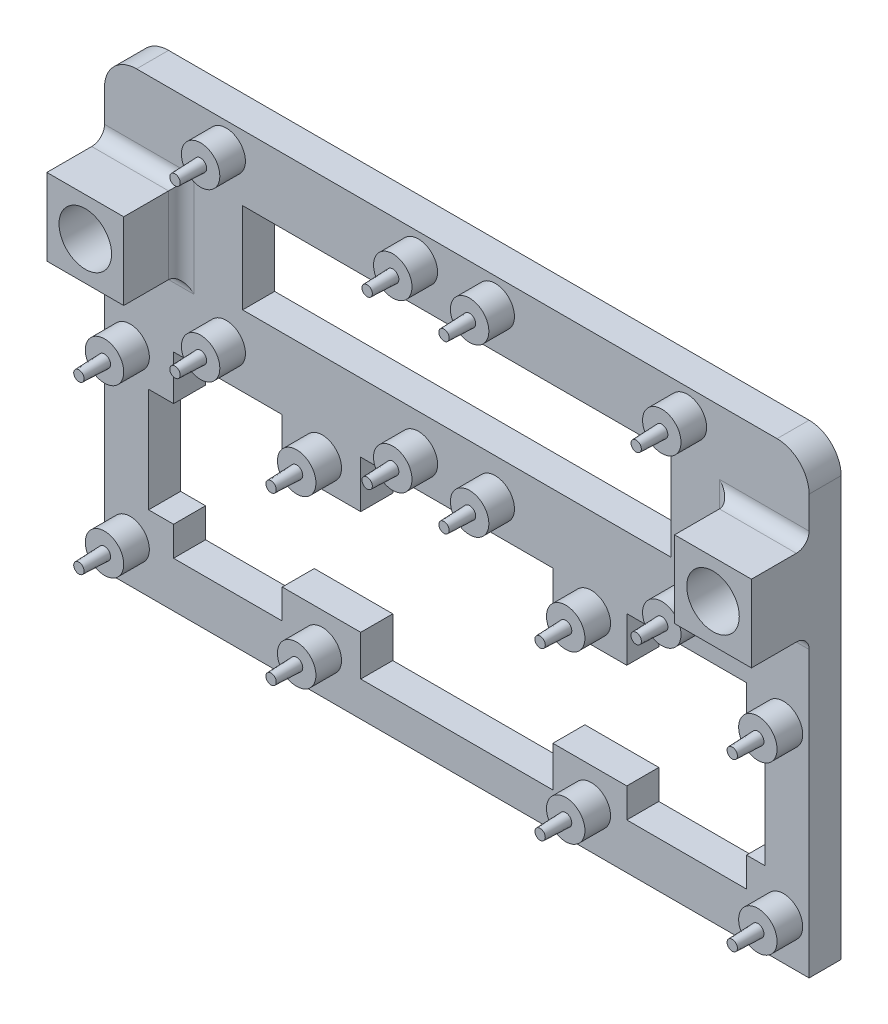
from build123d import *

# Parameters (mm, degrees)
SKIZZE1_W                                  = 110
SKIZZE1_H                                  = 170
AUFSATZ_LINEAR_AUSTRAGEN1_DEPTH            = 5
VERRUNDUNG1_R                              = 5
SKIZZE7_W                                  = 12
SKIZZE7_H                                  = 12
AUFSATZ_LINEAR_AUSTRAGEN3_DEPTH            = 28
VERRUNDUNG2_R                              = 2
SKIZZE8_R                                  = 4.1
SCHNITT_LINEAR_AUSTRAGEN3_DEPTH            = 107.484740691
LINEARES_MUSTER1_COUNT                     = 2
LINEARES_MUSTER1_PITCH                     = 134
LINEARES_MUSTER1_COUNT_DIR2                = 2
LINEARES_MUSTER1_PITCH_DIR2                = 98
SKIZZE9_R                                  = 3
AUFSATZ_LINEAR_AUSTRAGEN4_DEPTH            = 4
SKIZZE10_R                                 = 0.95
AUFSATZ_LINEAR_AUSTRAGEN5_DEPTH            = 4
AUFSATZ_LINEAR_AUSTRAGEN5_DRAFT            = 2
AUFSATZ_LINEAR_AUSTRAGEN5_PROFILE_2_DEPTH  = 4
AUFSATZ_LINEAR_AUSTRAGEN5_PROFILE_2_DRAFT  = 2
AUFSATZ_LINEAR_AUSTRAGEN5_PROFILE_3_DEPTH  = 4
AUFSATZ_LINEAR_AUSTRAGEN5_PROFILE_3_DRAFT  = 2
AUFSATZ_LINEAR_AUSTRAGEN5_PROFILE_4_DEPTH  = 4
AUFSATZ_LINEAR_AUSTRAGEN5_PROFILE_4_DRAFT  = 2
AUFSATZ_LINEAR_AUSTRAGEN5_PROFILE_5_DEPTH  = 4
AUFSATZ_LINEAR_AUSTRAGEN5_PROFILE_5_DRAFT  = 2
AUFSATZ_LINEAR_AUSTRAGEN5_PROFILE_6_DEPTH  = 4
AUFSATZ_LINEAR_AUSTRAGEN5_PROFILE_6_DRAFT  = 2
AUFSATZ_LINEAR_AUSTRAGEN5_PROFILE_7_DEPTH  = 4
AUFSATZ_LINEAR_AUSTRAGEN5_PROFILE_7_DRAFT  = 2
AUFSATZ_LINEAR_AUSTRAGEN5_PROFILE_8_DEPTH  = 4
AUFSATZ_LINEAR_AUSTRAGEN5_PROFILE_8_DRAFT  = 2
AUFSATZ_LINEAR_AUSTRAGEN5_PROFILE_9_DEPTH  = 4
AUFSATZ_LINEAR_AUSTRAGEN5_PROFILE_9_DRAFT  = 2
AUFSATZ_LINEAR_AUSTRAGEN5_PROFILE_10_DEPTH = 4
AUFSATZ_LINEAR_AUSTRAGEN5_PROFILE_10_DRAFT = 2
AUFSATZ_LINEAR_AUSTRAGEN5_PROFILE_11_DEPTH = 4
AUFSATZ_LINEAR_AUSTRAGEN5_PROFILE_11_DRAFT = 2
AUFSATZ_LINEAR_AUSTRAGEN5_PROFILE_12_DEPTH = 4
AUFSATZ_LINEAR_AUSTRAGEN5_PROFILE_12_DRAFT = 2
AUFSATZ_LINEAR_AUSTRAGEN5_PROFILE_13_DEPTH = 4
AUFSATZ_LINEAR_AUSTRAGEN5_PROFILE_13_DRAFT = 2
AUFSATZ_LINEAR_AUSTRAGEN5_PROFILE_14_DEPTH = 4
AUFSATZ_LINEAR_AUSTRAGEN5_PROFILE_14_DRAFT = 2
AUFSATZ_LINEAR_AUSTRAGEN5_PROFILE_15_DEPTH = 4
AUFSATZ_LINEAR_AUSTRAGEN5_PROFILE_15_DRAFT = 2
AUFSATZ_LINEAR_AUSTRAGEN5_PROFILE_16_DEPTH = 4
AUFSATZ_LINEAR_AUSTRAGEN5_PROFILE_16_DRAFT = 2
AUFSATZ_LINEAR_AUSTRAGEN5_PROFILE_17_DEPTH = 4
AUFSATZ_LINEAR_AUSTRAGEN5_PROFILE_17_DRAFT = 2
AUFSATZ_LINEAR_AUSTRAGEN5_PROFILE_18_DEPTH = 4
AUFSATZ_LINEAR_AUSTRAGEN5_PROFILE_18_DRAFT = 2
AUFSATZ_LINEAR_AUSTRAGEN5_PROFILE_19_DEPTH = 4
AUFSATZ_LINEAR_AUSTRAGEN5_PROFILE_19_DRAFT = 2
AUFSATZ_LINEAR_AUSTRAGEN5_PROFILE_20_DEPTH = 4
AUFSATZ_LINEAR_AUSTRAGEN5_PROFILE_20_DRAFT = 2
FASE1_SIZE                                 = 1.2
SKIZZE11_W                                 = 30
SKIZZE11_H                                 = 30
SCHNITT_LINEAR_AUSTRAGEN4_DEPTH            = 106.0428484
SCHNITT_LINEAR_AUSTRAGEN5_DEPTH            = 106.0428484
SCHNITT_LINEAR_AUSTRAGEN5_DEPTH_BACK       = 106.0428484
SKIZZE12_W                                 = 127.246732026
SKIZZE12_H                                 = 102.785709754
SKIZZE13_W                                 = 132.216184194
SKIZZE13_H                                 = 22.314967796
SCHNITT_LINEAR_AUSTRAGEN6_DEPTH            = 19
SKIZZE14_W                                 = 16.970787643
SKIZZE14_H                                 = 27.901125447
SKIZZE14_W_2                               = 66.876408934
SKIZZE14_H_2                               = 14.094382958
SKIZZE14_W_3                               = 18.696630454
SCHNITT_LINEAR_AUSTRAGEN7_DEPTH            = 102.641526946
SKIZZE15_W                                 = 96.238062378
SKIZZE15_H                                 = 16.307348182
SCHNITT_LINEAR_AUSTRAGEN8_DEPTH            = 102.641526946


with BuildPart() as part:
    # Skizze1 → Aufsatz-Linear austragen1 (new body)
    with BuildSketch(Plane.XY):
        Rectangle(SKIZZE1_W, SKIZZE1_H)
    extrude(amount=AUFSATZ_LINEAR_AUSTRAGEN1_DEPTH)

    # Verrundung1
    verrundung1_edges = [part.edges().sort_by_distance(p)[0] for p in [
        (55, -85, 2.5),
        (-55, -85, 2.5),
        (-55, 85, 2.5),
        (55, 85, 2.5),
    ]]
    fillet(verrundung1_edges, radius=VERRUNDUNG1_R)

    # Skizze7 → Aufsatz-Linear austragen3 (add)
    with BuildSketch(Plane.XY.offset(5)):
        with Locations((-49, 67)):
            Rectangle(SKIZZE7_W, SKIZZE7_H)
        with Locations((49, 67)):
            Rectangle(SKIZZE7_W, SKIZZE7_H)
        with Locations((49, -67)):
            Rectangle(SKIZZE7_W, SKIZZE7_H)
        with Locations((-49, -67)):
            Rectangle(SKIZZE7_W, SKIZZE7_H)
    extrude(amount=AUFSATZ_LINEAR_AUSTRAGEN3_DEPTH)

    # Verrundung2
    verrundung2_edges = [part.edges().sort_by_distance(p)[0] for p in [
        (-49, 61, 5),
        (-43, 67, 5),
        (-49, 73, 5),
        (49, 73, 5),
        (43, 67, 5),
        (49, 61, 5),
        (49, -61, 5),
        (43, -67, 5),
        (49, -73, 5),
        (-49, -73, 5),
        (-43, -67, 5),
        (-49, -61, 5),
    ]]
    fillet(verrundung2_edges, radius=VERRUNDUNG2_R)

    # Skizze8 → Schnitt-Linear austragen3 (cut, through all)
    with BuildSketch(Plane.XY.offset(33)):
        with Locations((-49, 67)):
            Circle(SKIZZE8_R)
    schnitt_linear_austragen3 = extrude(amount=-SCHNITT_LINEAR_AUSTRAGEN3_DEPTH, mode=Mode.SUBTRACT)

    # Lineares Muster1: Schnitt-Linear austragen3 2 × 2
    with Locations(*[(j * LINEARES_MUSTER1_PITCH_DIR2, -i * LINEARES_MUSTER1_PITCH, 0) for i in range(LINEARES_MUSTER1_COUNT) for j in range(LINEARES_MUSTER1_COUNT_DIR2) if (i, j) != (0, 0)]):
        add(schnitt_linear_austragen3, mode=Mode.SUBTRACT)

    # Skizze9 → Aufsatz-Linear austragen4 (add)
    with BuildSketch(Plane.XY.offset(5)):
        with Locations(Location((24.75, -73.75, 0), (0, 0, 180))):
            Circle(SKIZZE9_R)
        with Locations(Location((24.75, -16.25, 0), (0, 0, 180))):
            Circle(SKIZZE9_R)
        with Locations(Location((-24.75, -16.25, 0), (0, 0, 180))):
            Circle(SKIZZE9_R)
        with Locations(Location((-24.75, -73.75, 0), (0, 0, 180))):
            Circle(SKIZZE9_R)
        with Locations(Location((-36, 81, 0), (0, 0, 180))):
            Circle(SKIZZE9_R)
        with Locations(Location((-6, 81, 0), (0, 0, 180))):
            Circle(SKIZZE9_R)
        with Locations(Location((-36, 55, 0), (0, 0, 180))):
            Circle(SKIZZE9_R)
        with Locations(Location((-6, 55, 0), (0, 0, 180))):
            Circle(SKIZZE9_R)
        with Locations(Location((6, 81, 0), (0, 0, 180))):
            Circle(SKIZZE9_R)
        with Locations(Location((36, 81, 0), (0, 0, 180))):
            Circle(SKIZZE9_R)
        with Locations(Location((36, 55, 0), (0, 0, 180))):
            Circle(SKIZZE9_R)
        with Locations(Location((6, 55, 0), (0, 0, 180))):
            Circle(SKIZZE9_R)
        with Locations(Location((21, 47, 0), (0, 0, 180))):
            Circle(SKIZZE9_R)
        with Locations(Location((51, 47, 0), (0, 0, 180))):
            Circle(SKIZZE9_R)
        with Locations(Location((51, 21, 0), (0, 0, 180))):
            Circle(SKIZZE9_R)
        with Locations(Location((21, 21, 0), (0, 0, 180))):
            Circle(SKIZZE9_R)
        with Locations(Location((-21, 47, 0), (0, 0, 180))):
            Circle(SKIZZE9_R)
        with Locations(Location((-51, 47, 0), (0, 0, 180))):
            Circle(SKIZZE9_R)
        with Locations(Location((-51, 21, 0), (0, 0, 180))):
            Circle(SKIZZE9_R)
        with Locations(Location((-21, 21, 0), (0, 0, 180))):
            Circle(SKIZZE9_R)
    extrude(amount=AUFSATZ_LINEAR_AUSTRAGEN4_DEPTH)


with BuildPart() as aufsatz_linear_austragen5_tool:
    # Skizze10 → Aufsatz-Linear austragen5 (with draft: the straight prism first)
    with BuildSketch(Plane.XY.offset(9)):
        with Locations((24.75, -73.75)):
            Circle(SKIZZE10_R)
    extrude(amount=AUFSATZ_LINEAR_AUSTRAGEN5_DEPTH)
    # Aufsatz-Linear austragen5: the draft: its side faces are tilted about the plane it starts from
    aufsatz_linear_austragen5_sides = [aufsatz_linear_austragen5_tool.faces().sort_by_distance(p)[0] for p in [
        (23.8, -73.75, 11),
    ]]
    draft(aufsatz_linear_austragen5_sides, Plane.XY.offset(9), AUFSATZ_LINEAR_AUSTRAGEN5_DRAFT)


with BuildPart() as part_1:
    add(part.part)

    # Aufsatz-Linear austragen5: add aufsatz_linear_austragen5_tool
    add(aufsatz_linear_austragen5_tool.part)


with BuildPart() as aufsatz_linear_austragen5_profile_2_tool:
    # Skizze10 → Aufsatz-Linear austragen5 profile 2 (with draft: the straight prism first)
    with BuildSketch(Plane.XY.offset(9)):
        with Locations((24.75, -16.25)):
            Circle(SKIZZE10_R)
    extrude(amount=AUFSATZ_LINEAR_AUSTRAGEN5_PROFILE_2_DEPTH)
    # Aufsatz-Linear austragen5 profile 2: the draft: its side faces are tilted about the plane it starts from
    aufsatz_linear_austragen5_profile_2_sides = [aufsatz_linear_austragen5_profile_2_tool.faces().sort_by_distance(p)[0] for p in [
        (23.8, -16.25, 11),
    ]]
    draft(aufsatz_linear_austragen5_profile_2_sides, Plane.XY.offset(9), AUFSATZ_LINEAR_AUSTRAGEN5_PROFILE_2_DRAFT)


with BuildPart() as part_2:
    add(part_1.part)

    # Aufsatz-Linear austragen5 profile 2: add aufsatz_linear_austragen5_profile_2_tool
    add(aufsatz_linear_austragen5_profile_2_tool.part)


with BuildPart() as aufsatz_linear_austragen5_profile_3_tool:
    # Skizze10 → Aufsatz-Linear austragen5 profile 3 (with draft: the straight prism first)
    with BuildSketch(Plane.XY.offset(9)):
        with Locations((-24.75, -16.25)):
            Circle(SKIZZE10_R)
    extrude(amount=AUFSATZ_LINEAR_AUSTRAGEN5_PROFILE_3_DEPTH)
    # Aufsatz-Linear austragen5 profile 3: the draft: its side faces are tilted about the plane it starts from
    aufsatz_linear_austragen5_profile_3_sides = [aufsatz_linear_austragen5_profile_3_tool.faces().sort_by_distance(p)[0] for p in [
        (-25.7, -16.25, 11),
    ]]
    draft(aufsatz_linear_austragen5_profile_3_sides, Plane.XY.offset(9), AUFSATZ_LINEAR_AUSTRAGEN5_PROFILE_3_DRAFT)


with BuildPart() as part_3:
    add(part_2.part)

    # Aufsatz-Linear austragen5 profile 3: add aufsatz_linear_austragen5_profile_3_tool
    add(aufsatz_linear_austragen5_profile_3_tool.part)


with BuildPart() as aufsatz_linear_austragen5_profile_4_tool:
    # Skizze10 → Aufsatz-Linear austragen5 profile 4 (with draft: the straight prism first)
    with BuildSketch(Plane.XY.offset(9)):
        with Locations((-24.75, -73.75)):
            Circle(SKIZZE10_R)
    extrude(amount=AUFSATZ_LINEAR_AUSTRAGEN5_PROFILE_4_DEPTH)
    # Aufsatz-Linear austragen5 profile 4: the draft: its side faces are tilted about the plane it starts from
    aufsatz_linear_austragen5_profile_4_sides = [aufsatz_linear_austragen5_profile_4_tool.faces().sort_by_distance(p)[0] for p in [
        (-25.7, -73.75, 11),
    ]]
    draft(aufsatz_linear_austragen5_profile_4_sides, Plane.XY.offset(9), AUFSATZ_LINEAR_AUSTRAGEN5_PROFILE_4_DRAFT)


with BuildPart() as part_4:
    add(part_3.part)

    # Aufsatz-Linear austragen5 profile 4: add aufsatz_linear_austragen5_profile_4_tool
    add(aufsatz_linear_austragen5_profile_4_tool.part)


with BuildPart() as aufsatz_linear_austragen5_profile_5_tool:
    # Skizze10 → Aufsatz-Linear austragen5 profile 5 (with draft: the straight prism first)
    with BuildSketch(Plane.XY.offset(9)):
        with Locations((-51, 47)):
            Circle(SKIZZE10_R)
    extrude(amount=AUFSATZ_LINEAR_AUSTRAGEN5_PROFILE_5_DEPTH)
    # Aufsatz-Linear austragen5 profile 5: the draft: its side faces are tilted about the plane it starts from
    aufsatz_linear_austragen5_profile_5_sides = [aufsatz_linear_austragen5_profile_5_tool.faces().sort_by_distance(p)[0] for p in [
        (-51.95, 47, 11),
    ]]
    draft(aufsatz_linear_austragen5_profile_5_sides, Plane.XY.offset(9), AUFSATZ_LINEAR_AUSTRAGEN5_PROFILE_5_DRAFT)


with BuildPart() as part_5:
    add(part_4.part)

    # Aufsatz-Linear austragen5 profile 5: add aufsatz_linear_austragen5_profile_5_tool
    add(aufsatz_linear_austragen5_profile_5_tool.part)


with BuildPart() as aufsatz_linear_austragen5_profile_6_tool:
    # Skizze10 → Aufsatz-Linear austragen5 profile 6 (with draft: the straight prism first)
    with BuildSketch(Plane.XY.offset(9)):
        with Locations((-51, 21)):
            Circle(SKIZZE10_R)
    extrude(amount=AUFSATZ_LINEAR_AUSTRAGEN5_PROFILE_6_DEPTH)
    # Aufsatz-Linear austragen5 profile 6: the draft: its side faces are tilted about the plane it starts from
    aufsatz_linear_austragen5_profile_6_sides = [aufsatz_linear_austragen5_profile_6_tool.faces().sort_by_distance(p)[0] for p in [
        (-51.95, 21, 11),
    ]]
    draft(aufsatz_linear_austragen5_profile_6_sides, Plane.XY.offset(9), AUFSATZ_LINEAR_AUSTRAGEN5_PROFILE_6_DRAFT)


with BuildPart() as part_6:
    add(part_5.part)

    # Aufsatz-Linear austragen5 profile 6: add aufsatz_linear_austragen5_profile_6_tool
    add(aufsatz_linear_austragen5_profile_6_tool.part)


with BuildPart() as aufsatz_linear_austragen5_profile_7_tool:
    # Skizze10 → Aufsatz-Linear austragen5 profile 7 (with draft: the straight prism first)
    with BuildSketch(Plane.XY.offset(9)):
        with Locations((-21, 21)):
            Circle(SKIZZE10_R)
    extrude(amount=AUFSATZ_LINEAR_AUSTRAGEN5_PROFILE_7_DEPTH)
    # Aufsatz-Linear austragen5 profile 7: the draft: its side faces are tilted about the plane it starts from
    aufsatz_linear_austragen5_profile_7_sides = [aufsatz_linear_austragen5_profile_7_tool.faces().sort_by_distance(p)[0] for p in [
        (-21.95, 21, 11),
    ]]
    draft(aufsatz_linear_austragen5_profile_7_sides, Plane.XY.offset(9), AUFSATZ_LINEAR_AUSTRAGEN5_PROFILE_7_DRAFT)


with BuildPart() as part_7:
    add(part_6.part)

    # Aufsatz-Linear austragen5 profile 7: add aufsatz_linear_austragen5_profile_7_tool
    add(aufsatz_linear_austragen5_profile_7_tool.part)


with BuildPart() as aufsatz_linear_austragen5_profile_8_tool:
    # Skizze10 → Aufsatz-Linear austragen5 profile 8 (with draft: the straight prism first)
    with BuildSketch(Plane.XY.offset(9)):
        with Locations((-21, 47)):
            Circle(SKIZZE10_R)
    extrude(amount=AUFSATZ_LINEAR_AUSTRAGEN5_PROFILE_8_DEPTH)
    # Aufsatz-Linear austragen5 profile 8: the draft: its side faces are tilted about the plane it starts from
    aufsatz_linear_austragen5_profile_8_sides = [aufsatz_linear_austragen5_profile_8_tool.faces().sort_by_distance(p)[0] for p in [
        (-21.95, 47, 11),
    ]]
    draft(aufsatz_linear_austragen5_profile_8_sides, Plane.XY.offset(9), AUFSATZ_LINEAR_AUSTRAGEN5_PROFILE_8_DRAFT)


with BuildPart() as part_8:
    add(part_7.part)

    # Aufsatz-Linear austragen5 profile 8: add aufsatz_linear_austragen5_profile_8_tool
    add(aufsatz_linear_austragen5_profile_8_tool.part)


with BuildPart() as aufsatz_linear_austragen5_profile_9_tool:
    # Skizze10 → Aufsatz-Linear austragen5 profile 9 (with draft: the straight prism first)
    with BuildSketch(Plane.XY.offset(9)):
        with Locations((-36, 55)):
            Circle(SKIZZE10_R)
    extrude(amount=AUFSATZ_LINEAR_AUSTRAGEN5_PROFILE_9_DEPTH)
    # Aufsatz-Linear austragen5 profile 9: the draft: its side faces are tilted about the plane it starts from
    aufsatz_linear_austragen5_profile_9_sides = [aufsatz_linear_austragen5_profile_9_tool.faces().sort_by_distance(p)[0] for p in [
        (-36.95, 55, 11),
    ]]
    draft(aufsatz_linear_austragen5_profile_9_sides, Plane.XY.offset(9), AUFSATZ_LINEAR_AUSTRAGEN5_PROFILE_9_DRAFT)


with BuildPart() as part_9:
    add(part_8.part)

    # Aufsatz-Linear austragen5 profile 9: add aufsatz_linear_austragen5_profile_9_tool
    add(aufsatz_linear_austragen5_profile_9_tool.part)


with BuildPart() as aufsatz_linear_austragen5_profile_10_tool:
    # Skizze10 → Aufsatz-Linear austragen5 profile 10 (with draft: the straight prism first)
    with BuildSketch(Plane.XY.offset(9)):
        with Locations((-6, 55)):
            Circle(SKIZZE10_R)
    extrude(amount=AUFSATZ_LINEAR_AUSTRAGEN5_PROFILE_10_DEPTH)
    # Aufsatz-Linear austragen5 profile 10: the draft: its side faces are tilted about the plane it starts from
    aufsatz_linear_austragen5_profile_10_sides = [aufsatz_linear_austragen5_profile_10_tool.faces().sort_by_distance(p)[0] for p in [
        (-6.95, 55, 11),
    ]]
    draft(aufsatz_linear_austragen5_profile_10_sides, Plane.XY.offset(9), AUFSATZ_LINEAR_AUSTRAGEN5_PROFILE_10_DRAFT)


with BuildPart() as part_10:
    add(part_9.part)

    # Aufsatz-Linear austragen5 profile 10: add aufsatz_linear_austragen5_profile_10_tool
    add(aufsatz_linear_austragen5_profile_10_tool.part)


with BuildPart() as aufsatz_linear_austragen5_profile_11_tool:
    # Skizze10 → Aufsatz-Linear austragen5 profile 11 (with draft: the straight prism first)
    with BuildSketch(Plane.XY.offset(9)):
        with Locations((6, 55)):
            Circle(SKIZZE10_R)
    extrude(amount=AUFSATZ_LINEAR_AUSTRAGEN5_PROFILE_11_DEPTH)
    # Aufsatz-Linear austragen5 profile 11: the draft: its side faces are tilted about the plane it starts from
    aufsatz_linear_austragen5_profile_11_sides = [aufsatz_linear_austragen5_profile_11_tool.faces().sort_by_distance(p)[0] for p in [
        (5.05, 55, 11),
    ]]
    draft(aufsatz_linear_austragen5_profile_11_sides, Plane.XY.offset(9), AUFSATZ_LINEAR_AUSTRAGEN5_PROFILE_11_DRAFT)


with BuildPart() as part_11:
    add(part_10.part)

    # Aufsatz-Linear austragen5 profile 11: add aufsatz_linear_austragen5_profile_11_tool
    add(aufsatz_linear_austragen5_profile_11_tool.part)


with BuildPart() as aufsatz_linear_austragen5_profile_12_tool:
    # Skizze10 → Aufsatz-Linear austragen5 profile 12 (with draft: the straight prism first)
    with BuildSketch(Plane.XY.offset(9)):
        with Locations((-36, 81)):
            Circle(SKIZZE10_R)
    extrude(amount=AUFSATZ_LINEAR_AUSTRAGEN5_PROFILE_12_DEPTH)
    # Aufsatz-Linear austragen5 profile 12: the draft: its side faces are tilted about the plane it starts from
    aufsatz_linear_austragen5_profile_12_sides = [aufsatz_linear_austragen5_profile_12_tool.faces().sort_by_distance(p)[0] for p in [
        (-36.95, 81, 11),
    ]]
    draft(aufsatz_linear_austragen5_profile_12_sides, Plane.XY.offset(9), AUFSATZ_LINEAR_AUSTRAGEN5_PROFILE_12_DRAFT)


with BuildPart() as part_12:
    add(part_11.part)

    # Aufsatz-Linear austragen5 profile 12: add aufsatz_linear_austragen5_profile_12_tool
    add(aufsatz_linear_austragen5_profile_12_tool.part)


with BuildPart() as aufsatz_linear_austragen5_profile_13_tool:
    # Skizze10 → Aufsatz-Linear austragen5 profile 13 (with draft: the straight prism first)
    with BuildSketch(Plane.XY.offset(9)):
        with Locations((-6, 81)):
            Circle(SKIZZE10_R)
    extrude(amount=AUFSATZ_LINEAR_AUSTRAGEN5_PROFILE_13_DEPTH)
    # Aufsatz-Linear austragen5 profile 13: the draft: its side faces are tilted about the plane it starts from
    aufsatz_linear_austragen5_profile_13_sides = [aufsatz_linear_austragen5_profile_13_tool.faces().sort_by_distance(p)[0] for p in [
        (-6.95, 81, 11),
    ]]
    draft(aufsatz_linear_austragen5_profile_13_sides, Plane.XY.offset(9), AUFSATZ_LINEAR_AUSTRAGEN5_PROFILE_13_DRAFT)


with BuildPart() as part_13:
    add(part_12.part)

    # Aufsatz-Linear austragen5 profile 13: add aufsatz_linear_austragen5_profile_13_tool
    add(aufsatz_linear_austragen5_profile_13_tool.part)


with BuildPart() as aufsatz_linear_austragen5_profile_14_tool:
    # Skizze10 → Aufsatz-Linear austragen5 profile 14 (with draft: the straight prism first)
    with BuildSketch(Plane.XY.offset(9)):
        with Locations((6, 81)):
            Circle(SKIZZE10_R)
    extrude(amount=AUFSATZ_LINEAR_AUSTRAGEN5_PROFILE_14_DEPTH)
    # Aufsatz-Linear austragen5 profile 14: the draft: its side faces are tilted about the plane it starts from
    aufsatz_linear_austragen5_profile_14_sides = [aufsatz_linear_austragen5_profile_14_tool.faces().sort_by_distance(p)[0] for p in [
        (5.05, 81, 11),
    ]]
    draft(aufsatz_linear_austragen5_profile_14_sides, Plane.XY.offset(9), AUFSATZ_LINEAR_AUSTRAGEN5_PROFILE_14_DRAFT)


with BuildPart() as part_14:
    add(part_13.part)

    # Aufsatz-Linear austragen5 profile 14: add aufsatz_linear_austragen5_profile_14_tool
    add(aufsatz_linear_austragen5_profile_14_tool.part)


with BuildPart() as aufsatz_linear_austragen5_profile_15_tool:
    # Skizze10 → Aufsatz-Linear austragen5 profile 15 (with draft: the straight prism first)
    with BuildSketch(Plane.XY.offset(9)):
        with Locations((36, 81)):
            Circle(SKIZZE10_R)
    extrude(amount=AUFSATZ_LINEAR_AUSTRAGEN5_PROFILE_15_DEPTH)
    # Aufsatz-Linear austragen5 profile 15: the draft: its side faces are tilted about the plane it starts from
    aufsatz_linear_austragen5_profile_15_sides = [aufsatz_linear_austragen5_profile_15_tool.faces().sort_by_distance(p)[0] for p in [
        (35.05, 81, 11),
    ]]
    draft(aufsatz_linear_austragen5_profile_15_sides, Plane.XY.offset(9), AUFSATZ_LINEAR_AUSTRAGEN5_PROFILE_15_DRAFT)


with BuildPart() as part_15:
    add(part_14.part)

    # Aufsatz-Linear austragen5 profile 15: add aufsatz_linear_austragen5_profile_15_tool
    add(aufsatz_linear_austragen5_profile_15_tool.part)


with BuildPart() as aufsatz_linear_austragen5_profile_16_tool:
    # Skizze10 → Aufsatz-Linear austragen5 profile 16 (with draft: the straight prism first)
    with BuildSketch(Plane.XY.offset(9)):
        with Locations((36, 55)):
            Circle(SKIZZE10_R)
    extrude(amount=AUFSATZ_LINEAR_AUSTRAGEN5_PROFILE_16_DEPTH)
    # Aufsatz-Linear austragen5 profile 16: the draft: its side faces are tilted about the plane it starts from
    aufsatz_linear_austragen5_profile_16_sides = [aufsatz_linear_austragen5_profile_16_tool.faces().sort_by_distance(p)[0] for p in [
        (35.05, 55, 11),
    ]]
    draft(aufsatz_linear_austragen5_profile_16_sides, Plane.XY.offset(9), AUFSATZ_LINEAR_AUSTRAGEN5_PROFILE_16_DRAFT)


with BuildPart() as part_16:
    add(part_15.part)

    # Aufsatz-Linear austragen5 profile 16: add aufsatz_linear_austragen5_profile_16_tool
    add(aufsatz_linear_austragen5_profile_16_tool.part)


with BuildPart() as aufsatz_linear_austragen5_profile_17_tool:
    # Skizze10 → Aufsatz-Linear austragen5 profile 17 (with draft: the straight prism first)
    with BuildSketch(Plane.XY.offset(9)):
        with Locations((21, 47)):
            Circle(SKIZZE10_R)
    extrude(amount=AUFSATZ_LINEAR_AUSTRAGEN5_PROFILE_17_DEPTH)
    # Aufsatz-Linear austragen5 profile 17: the draft: its side faces are tilted about the plane it starts from
    aufsatz_linear_austragen5_profile_17_sides = [aufsatz_linear_austragen5_profile_17_tool.faces().sort_by_distance(p)[0] for p in [
        (20.05, 47, 11),
    ]]
    draft(aufsatz_linear_austragen5_profile_17_sides, Plane.XY.offset(9), AUFSATZ_LINEAR_AUSTRAGEN5_PROFILE_17_DRAFT)


with BuildPart() as part_17:
    add(part_16.part)

    # Aufsatz-Linear austragen5 profile 17: add aufsatz_linear_austragen5_profile_17_tool
    add(aufsatz_linear_austragen5_profile_17_tool.part)


with BuildPart() as aufsatz_linear_austragen5_profile_18_tool:
    # Skizze10 → Aufsatz-Linear austragen5 profile 18 (with draft: the straight prism first)
    with BuildSketch(Plane.XY.offset(9)):
        with Locations((51, 47)):
            Circle(SKIZZE10_R)
    extrude(amount=AUFSATZ_LINEAR_AUSTRAGEN5_PROFILE_18_DEPTH)
    # Aufsatz-Linear austragen5 profile 18: the draft: its side faces are tilted about the plane it starts from
    aufsatz_linear_austragen5_profile_18_sides = [aufsatz_linear_austragen5_profile_18_tool.faces().sort_by_distance(p)[0] for p in [
        (50.05, 47, 11),
    ]]
    draft(aufsatz_linear_austragen5_profile_18_sides, Plane.XY.offset(9), AUFSATZ_LINEAR_AUSTRAGEN5_PROFILE_18_DRAFT)


with BuildPart() as part_18:
    add(part_17.part)

    # Aufsatz-Linear austragen5 profile 18: add aufsatz_linear_austragen5_profile_18_tool
    add(aufsatz_linear_austragen5_profile_18_tool.part)


with BuildPart() as aufsatz_linear_austragen5_profile_19_tool:
    # Skizze10 → Aufsatz-Linear austragen5 profile 19 (with draft: the straight prism first)
    with BuildSketch(Plane.XY.offset(9)):
        with Locations((21, 21)):
            Circle(SKIZZE10_R)
    extrude(amount=AUFSATZ_LINEAR_AUSTRAGEN5_PROFILE_19_DEPTH)
    # Aufsatz-Linear austragen5 profile 19: the draft: its side faces are tilted about the plane it starts from
    aufsatz_linear_austragen5_profile_19_sides = [aufsatz_linear_austragen5_profile_19_tool.faces().sort_by_distance(p)[0] for p in [
        (20.05, 21, 11),
    ]]
    draft(aufsatz_linear_austragen5_profile_19_sides, Plane.XY.offset(9), AUFSATZ_LINEAR_AUSTRAGEN5_PROFILE_19_DRAFT)


with BuildPart() as part_19:
    add(part_18.part)

    # Aufsatz-Linear austragen5 profile 19: add aufsatz_linear_austragen5_profile_19_tool
    add(aufsatz_linear_austragen5_profile_19_tool.part)


with BuildPart() as aufsatz_linear_austragen5_profile_20_tool:
    # Skizze10 → Aufsatz-Linear austragen5 profile 20 (with draft: the straight prism first)
    with BuildSketch(Plane.XY.offset(9)):
        with Locations((51, 21)):
            Circle(SKIZZE10_R)
    extrude(amount=AUFSATZ_LINEAR_AUSTRAGEN5_PROFILE_20_DEPTH)
    # Aufsatz-Linear austragen5 profile 20: the draft: its side faces are tilted about the plane it starts from
    aufsatz_linear_austragen5_profile_20_sides = [aufsatz_linear_austragen5_profile_20_tool.faces().sort_by_distance(p)[0] for p in [
        (50.05, 21, 11),
    ]]
    draft(aufsatz_linear_austragen5_profile_20_sides, Plane.XY.offset(9), AUFSATZ_LINEAR_AUSTRAGEN5_PROFILE_20_DRAFT)


with BuildPart() as part_20:
    add(part_19.part)

    # Aufsatz-Linear austragen5 profile 20: add aufsatz_linear_austragen5_profile_20_tool
    add(aufsatz_linear_austragen5_profile_20_tool.part)

    # Fase1
    fase1_edges = [part_20.edges().sort_by_distance(p)[0] for p in [
        (-53.1, 67, 33),
        (44.9, 67, 33),
        (-53.1, -67, 33),
        (44.9, -67, 33),
    ]]
    chamfer(fase1_edges, length=FASE1_SIZE)

    # Skizze11 → Schnitt-Linear austragen4 (cut, through all)
    with BuildSketch(Plane.XY.offset(5)):
        with Locations((0, 35)):
            Rectangle(SKIZZE11_W, SKIZZE11_H)
    extrude(amount=-SCHNITT_LINEAR_AUSTRAGEN4_DEPTH, mode=Mode.SUBTRACT)

    # Skizze12 → Schnitt-Linear austragen5 (cut, two sides: drawn at the far end of the back side and taken through both)
    with BuildSketch(Plane.XY.offset(5).offset(-SCHNITT_LINEAR_AUSTRAGEN5_DEPTH_BACK)):
        with Locations((0, -36.815073926)):
            Rectangle(SKIZZE12_W, SKIZZE12_H)
    extrude(amount=SCHNITT_LINEAR_AUSTRAGEN5_DEPTH + SCHNITT_LINEAR_AUSTRAGEN5_DEPTH_BACK, mode=Mode.SUBTRACT)

    # Skizze13 → Schnitt-Linear austragen6 (cut)
    with BuildSketch(Plane.XY.offset(33)):
        with Locations((-1.45465504, 66.878424385)):
            Rectangle(SKIZZE13_W, SKIZZE13_H)
    extrude(amount=-SCHNITT_LINEAR_AUSTRAGEN6_DEPTH, mode=Mode.SUBTRACT)

    # Skizze14 → Schnitt-Linear austragen7 (cut, through all)
    with BuildSketch(Plane.XY.offset(5)):
        with Locations((-35.739328215, 35.667258796)):
            Rectangle(SKIZZE14_W, SKIZZE14_H)
        with Locations((0, 67.739171037)):
            Rectangle(SKIZZE14_W_2, SKIZZE14_H_2)
        with Locations((35.883148449, 35.667258796)):
            Rectangle(SKIZZE14_W_3, SKIZZE14_H)
    extrude(amount=-SCHNITT_LINEAR_AUSTRAGEN7_DEPTH, mode=Mode.SUBTRACT)

    # Skizze15 → Schnitt-Linear austragen8 (cut, through all)
    with BuildSketch(Plane.XY.offset(5)):
        with Locations((0, 34.469866426)):
            Rectangle(SKIZZE15_W, SKIZZE15_H)
    extrude(amount=-SCHNITT_LINEAR_AUSTRAGEN8_DEPTH, mode=Mode.SUBTRACT)


solid = part_20.part
